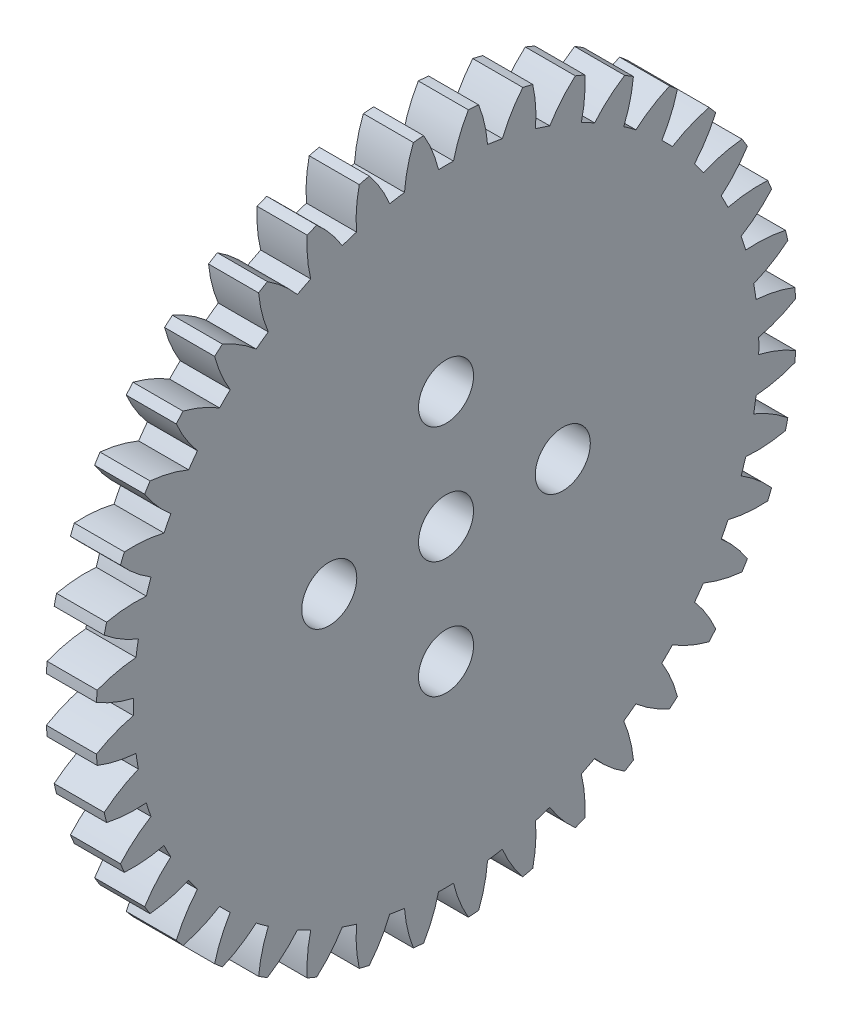
from build123d import *

# Parameters (mm, degrees)
BASPROSKE_W         = 3
BASPROSKE_H         = 21
TOOTHCUT_DEPTH      = 30.849623113
TEETHCUTS_COUNT     = 40
TEETHCUTS_ANGLE     = 351
BORSKE_R            = 0.5
BORE_DEPTH          = 50.0000508
CUT_EXTRUDE_1_REACH = 31.789
SKETCH_2_R          = 1.65


with BuildPart() as part:
    # BasProSke → Base-Revolve (revolve)
    with BuildSketch(Plane(origin=(0, 0, 0), x_dir=(1, 0, 0), z_dir=(0, 1, 0)), mode=Mode.PRIVATE) as base_revolve_sk:
        with Locations((1.5, 10.5)):
            Rectangle(BASPROSKE_W, BASPROSKE_H)
    revolve(base_revolve_sk.sketch.rotate(Axis((-10, 0, 0), (1, 0, 0)), 180), axis=Axis((-10, 0, 0), (1, 0, 0)))

    # TooCutSke → ToothCut (cut, through all)
    with BuildSketch(Plane(origin=(0, 0, 0), x_dir=(0, 0, -1), z_dir=(1, 0, 0))):
        with BuildLine():
            ThreePointArc((0.448673268, 18.74363074), (0, 18.749), (-0.448673268, 18.74363074))
            ThreePointArc((-0.448673268, 18.74363074), (-0.816786816, 19.89705013), (-1.354745081, 20.981708961))
            ThreePointArc((-1.354745081, 20.981708961), (0, 21.0254), (1.354745081, 20.981708961))
            ThreePointArc((1.354745081, 20.981708961), (0.816786816, 19.89705013), (0.448673268, 18.74363074))
        make_face()
    toothcut = extrude(amount=TOOTHCUT_DEPTH, mode=Mode.SUBTRACT)

    # TeethCuts: ToothCut ×40 about axis
    teethcuts_axis = Axis((-10, 0, 0), (1, 0, 0))
    for i in range(1, TEETHCUTS_COUNT):
        add(toothcut.rotate(teethcuts_axis, i * TEETHCUTS_ANGLE / (TEETHCUTS_COUNT - 1)), mode=Mode.SUBTRACT)

    # BorSke → Bore (cut, symmetric)
    with BuildSketch(Plane(origin=(0, 0, 0), x_dir=(0, 0, -1), z_dir=(1, 0, 0))):
        with Locations(Location((0, 0, 0), (0, 0, 180))):
            Circle(BORSKE_R)
    extrude(amount=BORE_DEPTH, both=True, mode=Mode.SUBTRACT)

    # 草图2 → 切除-拉伸1 (cut, up to next)
    with BuildSketch(Plane(origin=(3, 0, 0), x_dir=(0, 0, -1), z_dir=(1, 0, 0)), mode=Mode.PRIVATE) as cut_extrude_1_sk1:
        Circle(SKETCH_2_R)
    cut_extrude_1_tool1 = extrude(cut_extrude_1_sk1.sketch, amount=-CUT_EXTRUDE_1_REACH, mode=Mode.PRIVATE) & part.part
    # 草图2 → 切除-拉伸1 (cut, up to next)
    with BuildSketch(Plane(origin=(3, 0, 0), x_dir=(0, 0, -1), z_dir=(1, 0, 0)), mode=Mode.PRIVATE) as cut_extrude_1_sk2:
        with Locations((7, 0)):
            Circle(SKETCH_2_R)
    cut_extrude_1_tool2 = extrude(cut_extrude_1_sk2.sketch, amount=-CUT_EXTRUDE_1_REACH, mode=Mode.PRIVATE) & part.part
    # 草图2 → 切除-拉伸1 (cut, up to next)
    with BuildSketch(Plane(origin=(3, 0, 0), x_dir=(0, 0, -1), z_dir=(1, 0, 0)), mode=Mode.PRIVATE) as cut_extrude_1_sk3:
        with Locations((-7, 0)):
            Circle(SKETCH_2_R)
    cut_extrude_1_tool3 = extrude(cut_extrude_1_sk3.sketch, amount=-CUT_EXTRUDE_1_REACH, mode=Mode.PRIVATE) & part.part
    # 草图2 → 切除-拉伸1 (cut, up to next)
    with BuildSketch(Plane(origin=(3, 0, 0), x_dir=(0, 0, -1), z_dir=(1, 0, 0)), mode=Mode.PRIVATE) as cut_extrude_1_sk4:
        with Locations((0, 7)):
            Circle(SKETCH_2_R)
    cut_extrude_1_tool4 = extrude(cut_extrude_1_sk4.sketch, amount=-CUT_EXTRUDE_1_REACH, mode=Mode.PRIVATE) & part.part
    # 草图2 → 切除-拉伸1 (cut, up to next)
    with BuildSketch(Plane(origin=(3, 0, 0), x_dir=(0, 0, -1), z_dir=(1, 0, 0)), mode=Mode.PRIVATE) as cut_extrude_1_sk5:
        with Locations((0, -7)):
            Circle(SKETCH_2_R)
    cut_extrude_1_tool5 = extrude(cut_extrude_1_sk5.sketch, amount=-CUT_EXTRUDE_1_REACH, mode=Mode.PRIVATE) & part.part
    add(cut_extrude_1_tool1.solids().sort_by_distance((3, 0, 0))[0], mode=Mode.SUBTRACT)
    add(cut_extrude_1_tool2.solids().sort_by_distance((3, 0, -7))[0], mode=Mode.SUBTRACT)
    add(cut_extrude_1_tool3.solids().sort_by_distance((3, 0, 7))[0], mode=Mode.SUBTRACT)
    add(cut_extrude_1_tool4.solids().sort_by_distance((3, 7, 0))[0], mode=Mode.SUBTRACT)
    add(cut_extrude_1_tool5.solids().sort_by_distance((3, -7, 0))[0], mode=Mode.SUBTRACT)


solid = part.part
